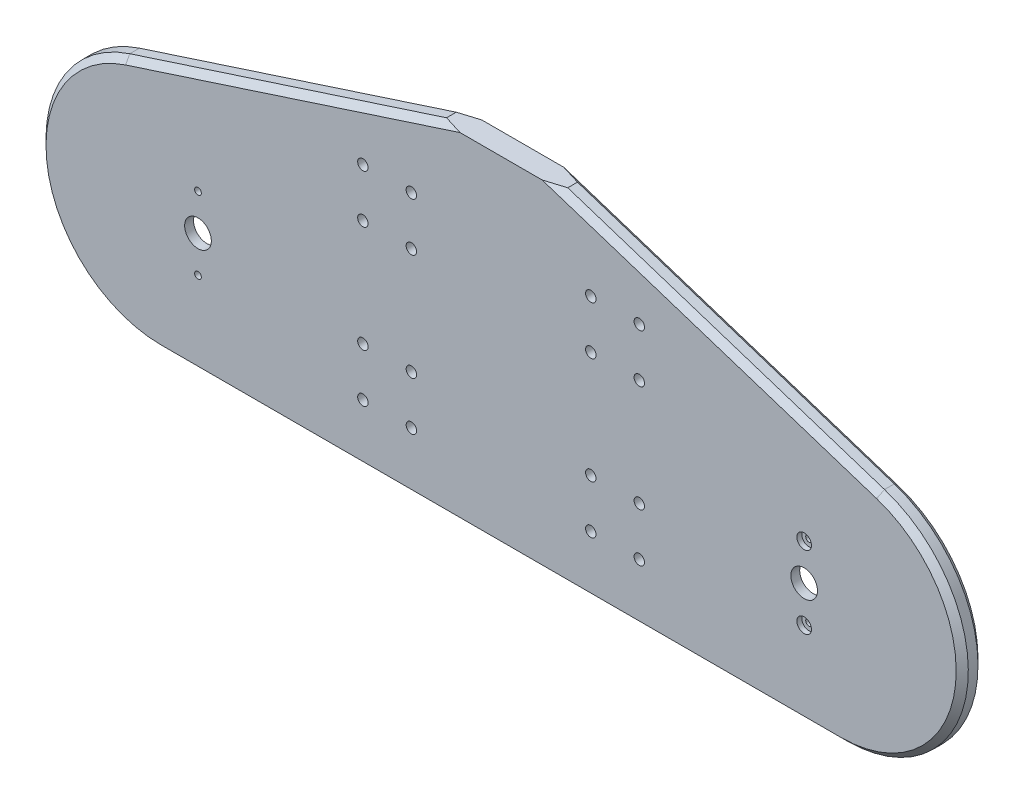
from build123d import *

# Parameters (mm, degrees)
SKETCH_1_R               = 11
EXTRUDE_1_DEPTH          = 8
FILLET_1_R               = 100
FILLET_3_R               = 100
EXTRUDE_2_DEPTH          = 10
FILLET_2_R               = 10
CHAMFER_1_SIZE           = 5
SKETCH_4_R               = 13
CUT_EXTRUDE_1_DEPTH      = 0.7
SKETCH_5_R               = 2.75
CUT_EXTRUDE_2_DEPTH      = 514.540365546
SKETCH_6_R               = 6
CUT_EXTRUDE_3_DEPTH      = 4
CUT_EXTRUDE_4_DEPTH      = 514.758413114
CUT_EXTRUDE_4_DEPTH_BACK = 514.758413114
SKETCH_7_R               = 4.3


with BuildPart() as part:
    # 草图1 → 凸台-拉伸1 (new body)
    with BuildSketch(Plane.XY):
        Polygon((0, 280), (861.751390409, 0), (0, 0), (-100, 0), (-961.751390409, 0), (-100, 280), align=None)
        with Locations((200, 100)):
            Circle(SKETCH_1_R, mode=Mode.SUBTRACT)
        with Locations(Location((-300, 100, 0), (0, 0, 180))):
            Circle(SKETCH_1_R, mode=Mode.SUBTRACT)
    extrude(amount=EXTRUDE_1_DEPTH)

    # 圆角1
    fillet_1_edges = [part.edges().sort_by_distance(p)[0] for p in [
        (861.751390409, 0, 4),
    ]]
    fillet(fillet_1_edges, radius=FILLET_1_R)

    # 圆角3
    fillet_3_edges = [part.edges().sort_by_distance(p)[0] for p in [
        (-961.751390409, 0, 4),
    ]]
    fillet(fillet_3_edges, radius=FILLET_3_R)

    # 草图2 → 凸台-拉伸2 (add)
    with BuildSketch(Plane.XY):
        with BuildLine():
            Line((0, 280), (-100, 280))
            Line((-100, 280), (-361.277938379, 195.10565163))
            ThreePointArc((-361.277938379, 195.10565163), (-429.145073001, 84.356553496), (-330.376238942, 0))
            Line((-330.376238942, 0), (230.376238942, 0))
            ThreePointArc((230.376238942, 0), (329.145073001, 84.356553496), (261.277938379, 195.10565163))
            Line((261.277938379, 195.10565163), (0, 280))
        make_face()
        Polygon((10, 266.236180795), (122.241374643, 229.766747442), (10, 35.358983849), align=None, mode=Mode.SUBTRACT)
        with BuildLine():
            Line((230.376238942, 10), (30, 10))
            Line((30, 10), (151.410485182, 220.289128906))
            Line((151.410485182, 220.289128906), (258.187768435, 185.595086467))
            ThreePointArc((258.187768435, 185.595086467), (319.268189595, 85.920898146), (230.376238942, 10))
        make_face(mode=Mode.SUBTRACT)
        Polygon((-110, 266.236180795), (-110, 35.358983849), (-222.241374643, 229.766747442), align=None, mode=Mode.SUBTRACT)
        with BuildLine():
            Line((-358.187768435, 185.595086467), (-251.410485182, 220.289128906))
            Line((-251.410485182, 220.289128906), (-130, 10))
            Line((-130, 10), (-330.376238942, 10))
            ThreePointArc((-330.376238942, 10), (-419.268189595, 85.920898146), (-358.187768435, 185.595086467))
        make_face(mode=Mode.SUBTRACT)
    extrude(amount=-EXTRUDE_2_DEPTH)

    # 圆角2
    fillet_2_edges = [part.edges().sort_by_distance(p)[0] for p in [
        (-110, 35.358983849, -5),
        (-110, 266.236180795, -5),
        (-130, 10, -5),
        (10, 266.236180795, -5),
        (10, 35.358983849, -5),
        (151.410485182, 220.289128906, -5),
        (30, 10, -5),
        (-251.410485182, 220.289128906, -5),
        (122.241374643, 229.766747442, -5),
        (-222.241374643, 229.766747442, -5),
    ]]
    fillet(fillet_2_edges, radius=FILLET_2_R)

    # 倒角1
    chamfer_1_edges = [part.edges().sort_by_distance(p)[0] for p in [
        (-230.63896919, 237.552825815, 8),
        (130.63896919, 237.552825815, 8),
        (329.145073001, 84.356553496, 8),
        (-50, 0, 8),
        (-429.145073001, 84.356553496, 8),
        (-230.63896919, 237.552825815, -10),
        (130.63896919, 237.552825815, -10),
        (329.145073001, 84.356553496, -10),
        (-50, 0, -10),
        (-429.145073001, 84.356553496, -10),
    ]]
    chamfer(chamfer_1_edges, length=CHAMFER_1_SIZE)

    # 草图4 → 切除-拉伸1 (cut)
    with BuildSketch(Plane(origin=(0, 0, 0), x_dir=(-1, 0, 0), z_dir=(0, 0, -1))):
        with Locations((-200, 100)):
            Circle(SKETCH_4_R)
        with Locations((300, 100)):
            Circle(SKETCH_4_R)
    extrude(amount=-CUT_EXTRUDE_1_DEPTH, mode=Mode.SUBTRACT)

    # 草图5 → 切除-拉伸2 (cut, through all)
    with BuildSketch(Plane(origin=(0, 0, 0), x_dir=(-1, 0, 0), z_dir=(0, 0, -1))):
        with Locations((-200, 130)):
            Circle(SKETCH_5_R)
        with Locations((-200, 70)):
            Circle(SKETCH_5_R)
        with Locations((300, 130)):
            Circle(SKETCH_5_R)
        with Locations((300, 70)):
            Circle(SKETCH_5_R)
    extrude(amount=-CUT_EXTRUDE_2_DEPTH, mode=Mode.SUBTRACT)

    # 草图6 → 切除-拉伸3 (cut)
    with BuildSketch(Plane.XY.offset(8)):
        with Locations((200, 130)):
            Circle(SKETCH_6_R)
        with Locations((200, 70)):
            Circle(SKETCH_6_R)
    extrude(amount=-CUT_EXTRUDE_3_DEPTH, mode=Mode.SUBTRACT)

    # 草图7 → 切除-拉伸4 (cut, two sides: drawn at the far end of the back side and taken through both)
    with BuildSketch(Plane.XY.offset(8).offset(-CUT_EXTRUDE_4_DEPTH_BACK)):
        with Locations((64, 217)):
            Circle(SKETCH_7_R)
        with Locations((24, 217)):
            Circle(SKETCH_7_R)
        with Locations((64, 177)):
            Circle(SKETCH_7_R)
        with Locations((24, 177)):
            Circle(SKETCH_7_R)
        with Locations((64, 89)):
            Circle(SKETCH_7_R)
        with Locations((24, 89)):
            Circle(SKETCH_7_R)
        with Locations((64, 49)):
            Circle(SKETCH_7_R)
        with Locations((24, 49)):
            Circle(SKETCH_7_R)
        with Locations(Location((-124, 49, 0), (0, 0, 180))):
            Circle(SKETCH_7_R)
        with Locations(Location((-164, 49, 0), (0, 0, 180))):
            Circle(SKETCH_7_R)
        with Locations(Location((-124, 89, 0), (0, 0, 180))):
            Circle(SKETCH_7_R)
        with Locations(Location((-164, 89, 0), (0, 0, 180))):
            Circle(SKETCH_7_R)
        with Locations(Location((-124, 177, 0), (0, 0, 180))):
            Circle(SKETCH_7_R)
        with Locations(Location((-164, 177, 0), (0, 0, 180))):
            Circle(SKETCH_7_R)
        with Locations(Location((-124, 217, 0), (0, 0, 180))):
            Circle(SKETCH_7_R)
        with Locations(Location((-164, 217, 0), (0, 0, 180))):
            Circle(SKETCH_7_R)
    extrude(amount=CUT_EXTRUDE_4_DEPTH + CUT_EXTRUDE_4_DEPTH_BACK, mode=Mode.SUBTRACT)


solid = part.part
